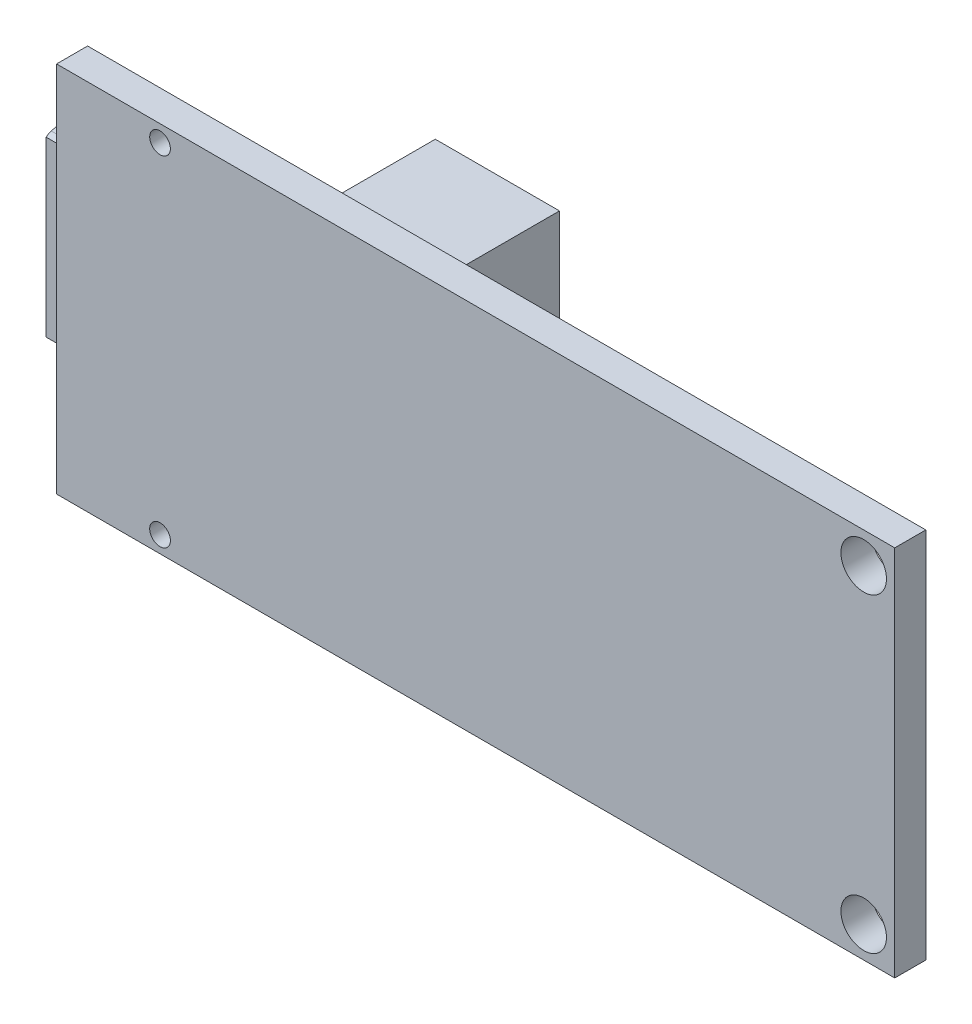
from build123d import *

# Parameters (mm, degrees)
IZIM1_W                     = 40.5
IZIM1_H                     = 18
Y_KSEKLIK_EKSTR_ZYON1_DEPTH = 1.5
IZIM2_R                     = 1.1
KES_EKSTR_ZYON1_DEPTH       = 1.5
IZIM3_W                     = 6
IZIM3_H                     = 6
Y_KSEKLIK_EKSTR_ZYON2_DEPTH = 4.8
IZIM4_W                     = 6
IZIM4_H                     = 9
Y_KSEKLIK_EKSTR_ZYON3_DEPTH = 3
KES_EKSTR_ZYON2_DEPTH       = 6
KES_EKSTR_ZYON3_DEPTH       = 5
IZIM8_R                     = 0.5
KES_EKSTR_ZYON4_DEPTH       = 5
Y_KSEKLIK_EKSTR_ZYON4_START = 4
Y_KSEKLIK_EKSTR_ZYON4_DEPTH = 4


with BuildPart() as part:
    # Çizim1 → Yükseklik-Ekstrüzyon1 (new body)
    with BuildSketch(Plane.XY):
        Rectangle(IZIM1_W, IZIM1_H)
    extrude(amount=Y_KSEKLIK_EKSTR_ZYON1_DEPTH)

    # Çizim2 → Kes-Ekstrüzyon1 (cut)
    with BuildSketch(Plane(origin=(0, 0, 0), x_dir=(-1, 0, 0), z_dir=(0, 0, -1))):
        with Locations((-18.75, 7.5)):
            Circle(IZIM2_R)
        with Locations((-18.75, -7.5)):
            Circle(IZIM2_R)
    extrude(amount=-KES_EKSTR_ZYON1_DEPTH, mode=Mode.SUBTRACT)

    # Çizim3 → Yükseklik-Ekstrüzyon2 (add)
    with BuildSketch(Plane(origin=(0, 0, 0), x_dir=(-1, 0, 0), z_dir=(0, 0, -1))):
        with Locations((5.25, 5.7)):
            Rectangle(IZIM3_W, IZIM3_H)
    extrude(amount=Y_KSEKLIK_EKSTR_ZYON2_DEPTH)

    # Çizim4 → Yükseklik-Ekstrüzyon3 (add)
    with BuildSketch(Plane(origin=(0, 0, 0), x_dir=(-1, 0, 0), z_dir=(0, 0, -1))):
        with Locations((15.25, 0)):
            Rectangle(IZIM4_W, IZIM4_H)
    extrude(amount=Y_KSEKLIK_EKSTR_ZYON3_DEPTH)

    # Çizim6 → Kes-Ekstrüzyon2 (cut)
    with BuildSketch(Plane.ZY.offset(18.25)):
        with BuildLine():
            ThreePointArc((-2.960618191, -4.326328271), (-2.980432326, -4.320748503), (-3, -4.314357896))
            Line((-3, -4.314357896), (-3, -4.5))
            Line((-3, -4.5), (-1.6, -4.5))
            ThreePointArc((-1.6, -4.5), (-2.285828647, -4.456406648), (-2.960618191, -4.326328271))
        make_face()
        with BuildLine():
            Line((-3, 4.5), (-3, 4.314357896))
            ThreePointArc((-3, 4.314357896), (-2.980432326, 4.320748503), (-2.960618191, 4.326328271))
            ThreePointArc((-2.960618191, 4.326328271), (-2.285828657, 4.456406647), (-1.60000002, 4.5))
            Line((-1.60000002, 4.5), (-3, 4.5))
        make_face()
        with BuildLine():
            ThreePointArc((-0.239381809, -4.326328271), (-0.914171353, -4.456406648), (-1.6, -4.5))
            Line((-1.6, -4.5), (0, -4.5))
            Line((0, -4.5), (0, -4.184107288))
            ThreePointArc((0, -4.184107288), (-0.109591088, -4.272217467), (-0.239381809, -4.326328271))
        make_face()
        with BuildLine():
            Line((0, 4.5), (-1.60000002, 4.5))
            ThreePointArc((-1.60000002, 4.5), (-0.914171363, 4.456406649), (-0.239381809, 4.326328271))
            ThreePointArc((-0.239381809, 4.326328271), (-0.109591088, 4.272217467), (0, 4.184107288))
            Line((0, 4.184107288), (0, 4.5))
        make_face()
    extrude(amount=-KES_EKSTR_ZYON2_DEPTH, mode=Mode.SUBTRACT)

    # Çizim7 → Kes-Ekstrüzyon3 (cut)
    with BuildSketch(Plane.ZY.offset(18.25)):
        with BuildLine():
            Line((-0.3, -4.031510098), (-0.3, 4.031510098))
            ThreePointArc((-0.3, 4.031510098), (-0.307326862, 4.033870403), (-0.314739124, 4.035947013))
            ThreePointArc((-0.314739124, 4.035947013), (-1.504744914, 4.199113259), (-2.7, 4.080360227))
            Line((-2.7, 4.080360227), (-2.7, -4.080360227))
            ThreePointArc((-2.7, -4.080360227), (-1.504744914, -4.199113259), (-0.314739124, -4.035947013))
            ThreePointArc((-0.314739124, -4.035947013), (-0.307326862, -4.033870403), (-0.3, -4.031510098))
        make_face()
    extrude(amount=-KES_EKSTR_ZYON3_DEPTH, mode=Mode.SUBTRACT)

    # Çizim8 → Kes-Ekstrüzyon4 (cut)
    with BuildSketch(Plane(origin=(0, 0, 0), x_dir=(-1, 0, 0), z_dir=(0, 0, -1))):
        with Locations((15.25, 8.2)):
            Circle(IZIM8_R)
        with Locations((15.25, -8.2)):
            Circle(IZIM8_R)
    extrude(amount=-KES_EKSTR_ZYON4_DEPTH, mode=Mode.SUBTRACT)

    # Çizim9 → Yükseklik-Ekstrüzyon4 (add)
    with BuildSketch(Plane.ZY.offset(18.25).offset(Y_KSEKLIK_EKSTR_ZYON4_START)):
        with BuildLine():
            ThreePointArc((-0.239381809, -4.326328271), (-0.109591088, -4.272217467), (0, -4.184107288))
            Line((0, -4.184107288), (0, 4.184107288))
            ThreePointArc((0, 4.184107288), (-0.109591088, 4.272217467), (-0.239381809, 4.326328271))
            ThreePointArc((-0.239381809, 4.326328271), (-1.6, 4.5), (-2.960618191, 4.326328271))
            ThreePointArc((-2.960618191, 4.326328271), (-2.980432326, 4.320748503), (-3, 4.314357896))
            Line((-3, 4.314357896), (-3, -4.314357896))
            ThreePointArc((-3, -4.314357896), (-2.980432326, -4.320748503), (-2.960618191, -4.326328271))
            ThreePointArc((-2.960618191, -4.326328271), (-1.6, -4.5), (-0.239381809, -4.326328271))
        make_face()
        with BuildLine():
            Line((-0.3, 4.031510098), (-0.3, -4.031510098))
            ThreePointArc((-0.3, -4.031510098), (-0.307326862, -4.033870403), (-0.314739124, -4.035947013))
            ThreePointArc((-0.314739124, -4.035947013), (-1.504744914, -4.199113259), (-2.7, -4.080360227))
            Line((-2.7, -4.080360227), (-2.7, 4.080360227))
            ThreePointArc((-2.7, 4.080360227), (-1.504744914, 4.199113259), (-0.314739124, 4.035947013))
            ThreePointArc((-0.314739124, 4.035947013), (-0.307326862, 4.033870403), (-0.3, 4.031510098))
        make_face(mode=Mode.SUBTRACT)
    extrude(amount=-Y_KSEKLIK_EKSTR_ZYON4_DEPTH)


solid = part.part
